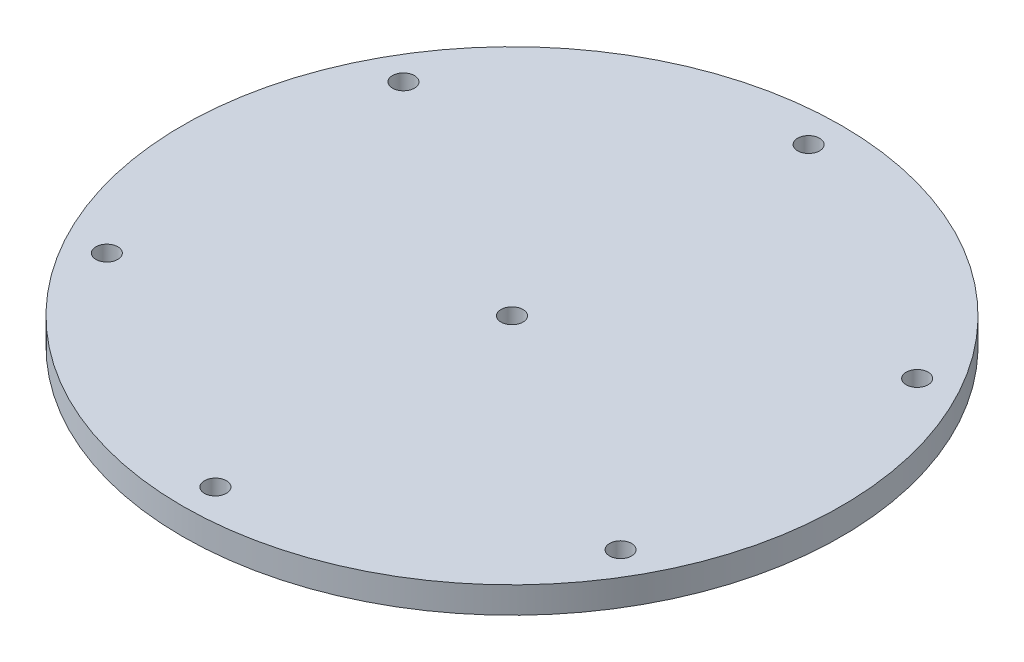
from build123d import *

# Parameters (mm, degrees)
SKETCH1_R           = 75
SKETCH1_R_2         = 2.5
BOSS_EXTRUDE1_DEPTH = 6


with BuildPart() as part:
    # Sketch1 → Boss-Extrude1 (new body)
    with BuildSketch(Plane(origin=(0, 0, 0), x_dir=(1, 0, 0), z_dir=(0, 1, 0))):
        with Locations(Location((0, 0, 0), (0, 0, 270))):
            Circle(SKETCH1_R)
        with Locations(Location((0, 67.5, 0), (0, 0, 270))):
            Circle(SKETCH1_R_2, mode=Mode.SUBTRACT)
        with Locations(Location((58.456714755, 33.75, 0), (0, 0, 270))):
            Circle(SKETCH1_R_2, mode=Mode.SUBTRACT)
        with Locations(Location((58.456714755, -33.75, 0), (0, 0, 270))):
            Circle(SKETCH1_R_2, mode=Mode.SUBTRACT)
        with Locations(Location((0, -67.5, 0), (0, 0, 270))):
            Circle(SKETCH1_R_2, mode=Mode.SUBTRACT)
        with Locations(Location((-58.456714755, -33.75, 0), (0, 0, 270))):
            Circle(SKETCH1_R_2, mode=Mode.SUBTRACT)
        with Locations(Location((-58.456714755, 33.75, 0), (0, 0, 270))):
            Circle(SKETCH1_R_2, mode=Mode.SUBTRACT)
        with Locations(Location((0, 0, 0), (0, 0, 270))):
            Circle(SKETCH1_R_2, mode=Mode.SUBTRACT)
    extrude(amount=BOSS_EXTRUDE1_DEPTH)


solid = part.part
